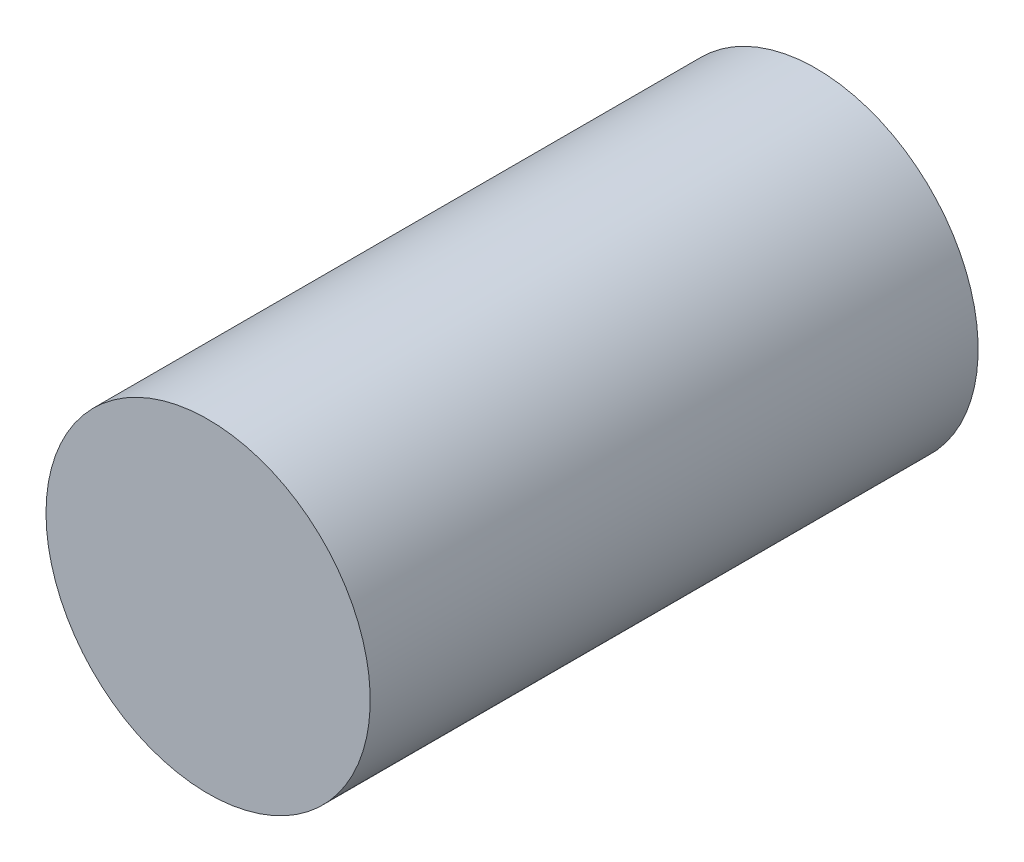
from build123d import *

# Parameters (mm, degrees)
SKETCH1_R           = 3
BOSS_EXTRUDE1_DEPTH = 11.25


with BuildPart() as part:
    # Sketch1 → Boss-Extrude1 (new body)
    with BuildSketch(Plane.XY):
        with Locations(Location((0, 0, 0), (0, 0, 180))):
            Circle(SKETCH1_R)
    extrude(amount=BOSS_EXTRUDE1_DEPTH)


solid = part.part
